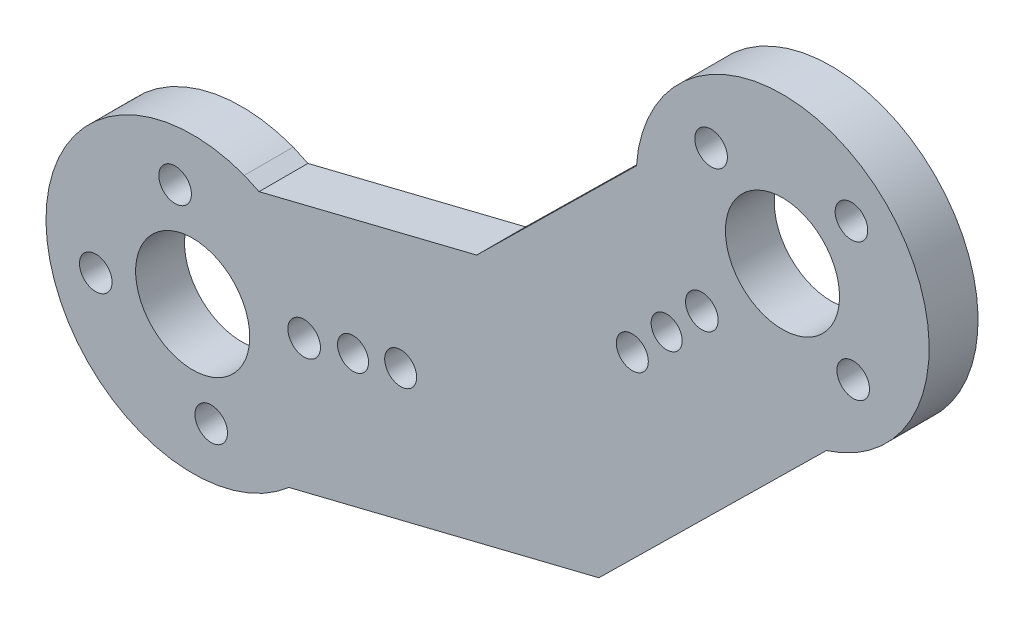
from build123d import *

# Parameters (mm, degrees)
SKETCH1_R       = 1
SKETCH1_R_2     = 3.5
SKETCH1_R_3     = 0.952573724
SKETCH1_R_4     = 0.980307261
EXTRUDE_6_DEPTH = 3


with BuildPart() as part:
    # Sketch1 → Бобышка-Вытянуть6 (new body)
    with BuildSketch(Plane.XY):
        with BuildLine():
            Line((-50.090575528, 20.246358773), (-63.443383911, 16.939772721))
            Line((-63.443383911, 16.939772721), (-64.348156071, 17.355557159))
            ThreePointArc((-64.348156071, 17.355557159), (-76.371742075, 7.335892912), (-61.608311767, 2.139604087))
            Line((-61.608311767, 2.139604087), (-42.594837437, 6.847953613))
            Line((-42.594837437, 6.847953613), (-28.633720832, 20.587239783))
            ThreePointArc((-28.633720832, 20.587239783), (-25.336971544, 35.887296519), (-40.166847554, 30.883790793))
            Line((-40.166847554, 30.883790793), (-40.285943738, 29.895203185))
            Line((-40.285943738, 29.895203185), (-50.090575528, 20.246358773))
        make_face()
        with Locations((-27.098820281, 33.552896146)):
            Circle(SKETCH1_R, mode=Mode.SUBTRACT)
        with Locations((-67.514190904, 8.930818383)):
            Circle(SKETCH1_R_2, mode=Mode.SUBTRACT)
        with Locations((-60.675780867, 10.535905116)):
            Circle(SKETCH1_R, mode=Mode.SUBTRACT)
        with Locations((-66.377650396, 3.14132137)):
            Circle(SKETCH1_R, mode=Mode.SUBTRACT)
        with Locations((-68.59259333, 14.731425956)):
            Circle(SKETCH1_R, mode=Mode.SUBTRACT)
        with Locations((-57.675780867, 11.227745586)):
            Circle(SKETCH1_R_3, mode=Mode.SUBTRACT)
        with Locations((-54.753543693, 11.906369118)):
            Circle(SKETCH1_R_4, mode=Mode.SUBTRACT)
        with Locations(Location((-40.543510307, 19.856172639, 0), (0, 0, 180))):
            Circle(SKETCH1_R_4, mode=Mode.SUBTRACT)
        with Locations(Location((-38.436147278, 21.991359062, 0), (0, 0, 180))):
            Circle(SKETCH1_R_3, mode=Mode.SUBTRACT)
        with Locations(Location((-35.709722432, 33.127748875, 0), (0, 0, 180))):
            Circle(SKETCH1_R, mode=Mode.SUBTRACT)
        with Locations(Location((-26.991820916, 25.175724624, 0), (0, 0, 180))):
            Circle(SKETCH1_R, mode=Mode.SUBTRACT)
        with Locations(Location((-36.27683183, 24.185897745, 0), (0, 0, 180))):
            Circle(SKETCH1_R, mode=Mode.SUBTRACT)
        with Locations(Location((-73.460528059, 7.615837609, 0), (0, 0, 180))):
            Circle(SKETCH1_R, mode=Mode.SUBTRACT)
        with Locations(Location((-31.330827271, 29.173602043, 0), (0, 0, 180))):
            Circle(SKETCH1_R_2, mode=Mode.SUBTRACT)
    extrude(amount=EXTRUDE_6_DEPTH)


solid = part.part
